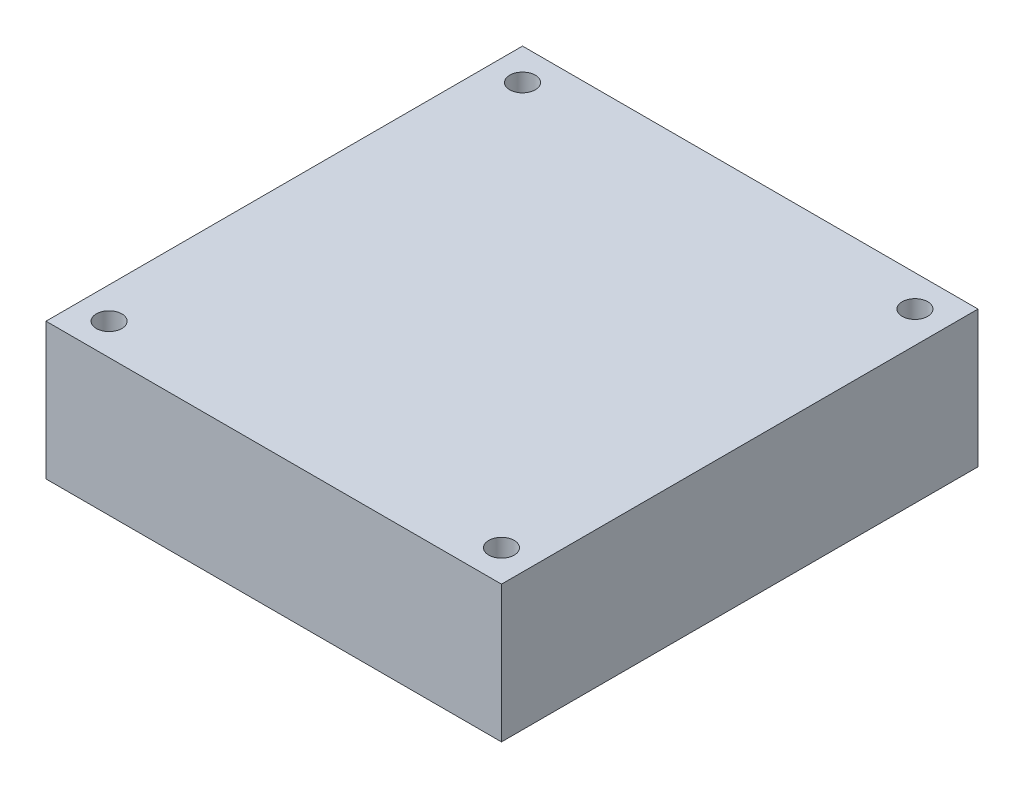
from build123d import *

# Parameters (mm, degrees)
SKETCH1_W           = 65
SKETCH1_H           = 68
BOSS_EXTRUDE1_DEPTH = 19.5
SKETCH2_R           = 1.819722277
CUT_EXTRUDE1_DEPTH  = 51.916598472


with BuildPart() as part:
    # Sketch1 → Boss-Extrude1 (new body)
    with BuildSketch(Plane(origin=(0, 0, 0), x_dir=(1, 0, 0), z_dir=(0, 1, 0))):
        Rectangle(SKETCH1_W, SKETCH1_H)
    extrude(amount=BOSS_EXTRUDE1_DEPTH)

    # Sketch2 → Cut-Extrude1 (cut, through all)
    with BuildSketch(Plane(origin=(0, 19.5, 0), x_dir=(1, 0, 0), z_dir=(0, 1, 0))):
        with Locations(Location((28, -29.5, 0), (0, 0, 270))):
            Circle(SKETCH2_R)
        with Locations(Location((-28, -29.5, 0), (0, 0, 90))):
            Circle(SKETCH2_R)
        with Locations(Location((28, 29.5, 0), (0, 0, 90))):
            Circle(SKETCH2_R)
        with Locations(Location((-28, 29.5, 0), (0, 0, 270))):
            Circle(SKETCH2_R)
    extrude(amount=-CUT_EXTRUDE1_DEPTH, mode=Mode.SUBTRACT)


solid = part.part
